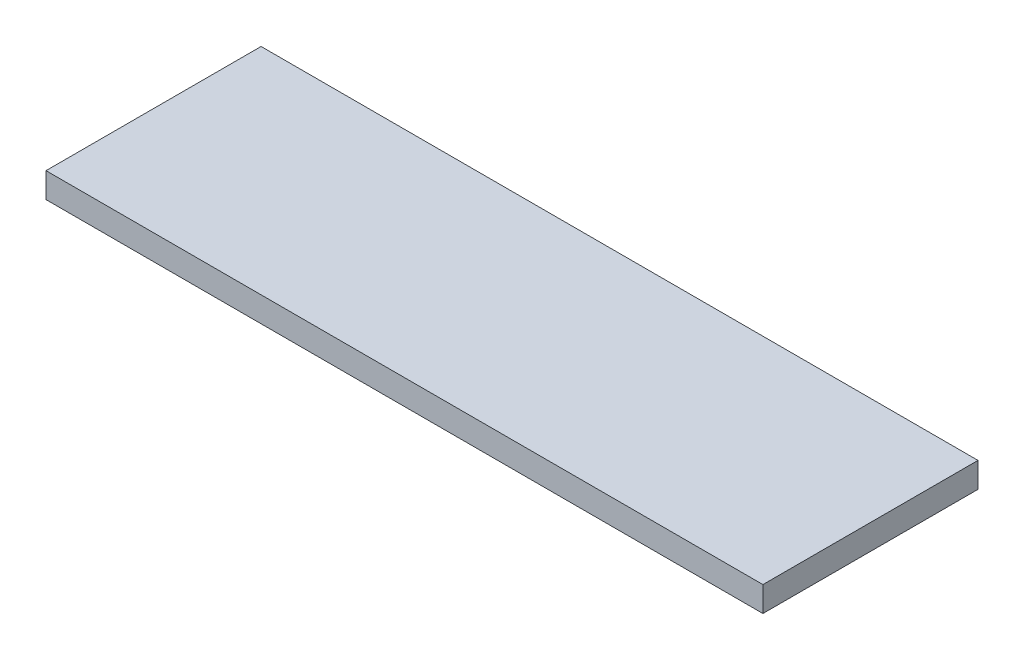
from build123d import *

# Parameters (mm, degrees)
SKETCH1_W           = 127
SKETCH1_H           = 38.1
BOSS_EXTRUDE1_DEPTH = 2.2225


with BuildPart() as part:
    # Sketch1 → Boss-Extrude1 (new, symmetric)
    with BuildSketch(Plane(origin=(0, 0, 0), x_dir=(1, 0, 0), z_dir=(0, 1, 0))):
        Rectangle(SKETCH1_W, SKETCH1_H)
    extrude(amount=BOSS_EXTRUDE1_DEPTH, both=True)


solid = part.part
